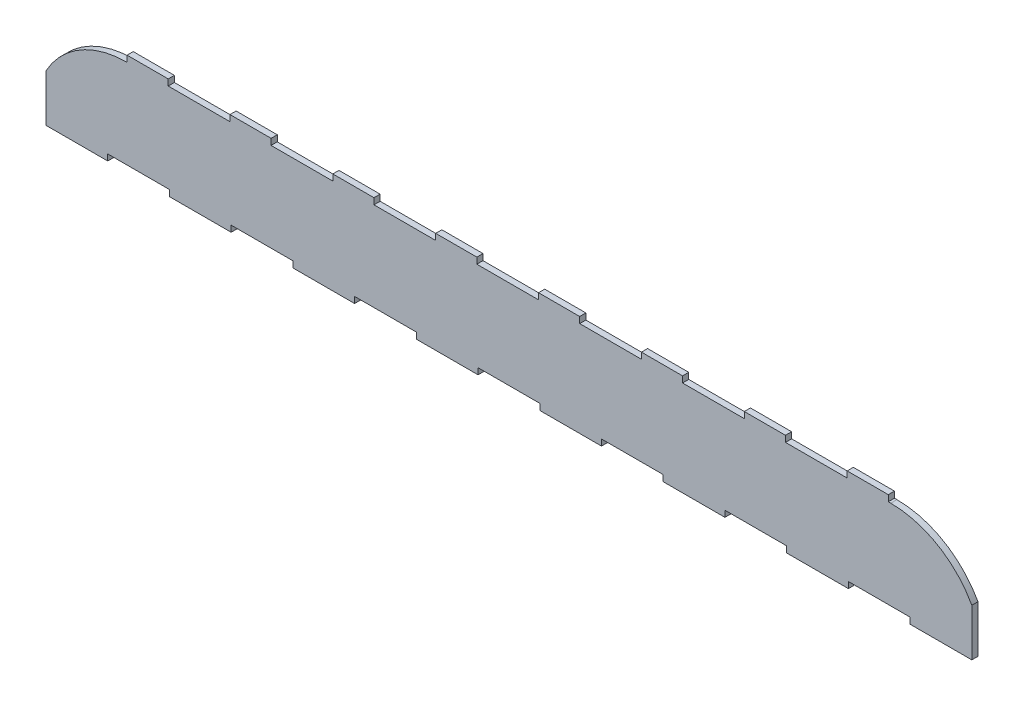
from build123d import *

# Parameters (mm, degrees)
BOSS_EXTRUDE1_DEPTH = 1.5
SKETCH3_W           = 30
SKETCH3_H           = 3
BOSS_EXTRUDE2_DEPTH = 3
SKETCH5_W           = 20
SKETCH5_H           = 3
BOSS_EXTRUDE3_DEPTH = 3


with BuildPart() as part:
    # Sketch2 → Boss-Extrude1 (new, symmetric)
    with BuildSketch(Plane.XY):
        with BuildLine():
            Line((-209.776110705, -9.374567854), (-209.776110705, 10.625432146))
            ThreePointArc((-209.776110705, 10.625432146), (-193.252620605, 27.63865465), (-170.374325813, 33.888382039))
            Line((-170.374325813, 33.888382039), (200.822104404, 33.888382039))
            ThreePointArc((200.822104404, 33.888382039), (223.700399196, 27.63865465), (240.223889295, 10.625432146))
            Line((240.223889295, 10.625432146), (240.223889295, -9.374567854))
            Line((240.223889295, -9.374567854), (-209.776110705, -9.374567854))
        make_face()
    extrude(amount=BOSS_EXTRUDE1_DEPTH, both=True)

    # Sketch3 → Boss-Extrude2 (add)
    with BuildSketch(Plane.XY.offset(1.5)):
        with Locations((-134.776110705, -10.874567854)):
            Rectangle(SKETCH3_W, SKETCH3_H)
        with Locations((-194.776110705, -10.874567854)):
            Rectangle(SKETCH3_W, SKETCH3_H)
        with Locations((-74.776110705, -10.874567854)):
            Rectangle(SKETCH3_W, SKETCH3_H)
        with Locations((-14.776110705, -10.874567854)):
            Rectangle(SKETCH3_W, SKETCH3_H)
        with Locations((45.223889295, -10.874567854)):
            Rectangle(SKETCH3_W, SKETCH3_H)
        with Locations((105.223889295, -10.874567854)):
            Rectangle(SKETCH3_W, SKETCH3_H)
        with Locations((165.223889295, -10.874567854)):
            Rectangle(SKETCH3_W, SKETCH3_H)
        with Locations((225.223889295, -10.874567854)):
            Rectangle(SKETCH3_W, SKETCH3_H)
    extrude(amount=-BOSS_EXTRUDE2_DEPTH)

    # Sketch5 → Boss-Extrude3 (add)
    with BuildSketch(Plane.XY.offset(1.5)):
        with Locations((-160.374325813, 35.388382039)):
            Rectangle(SKETCH5_W, SKETCH5_H)
        with Locations((-110.374325813, 35.388382039)):
            Rectangle(SKETCH5_W, SKETCH5_H)
        with Locations((-60.374325813, 35.388382039)):
            Rectangle(SKETCH5_W, SKETCH5_H)
        with Locations((-10.374325813, 35.388382039)):
            Rectangle(SKETCH5_W, SKETCH5_H)
        with Locations((39.625674187, 35.388382039)):
            Rectangle(SKETCH5_W, SKETCH5_H)
        with Locations((89.625674187, 35.388382039)):
            Rectangle(SKETCH5_W, SKETCH5_H)
        with Locations((139.625674187, 35.388382039)):
            Rectangle(SKETCH5_W, SKETCH5_H)
        with Locations((189.625674187, 35.388382039)):
            Rectangle(SKETCH5_W, SKETCH5_H)
    extrude(amount=-BOSS_EXTRUDE3_DEPTH)


solid = part.part
